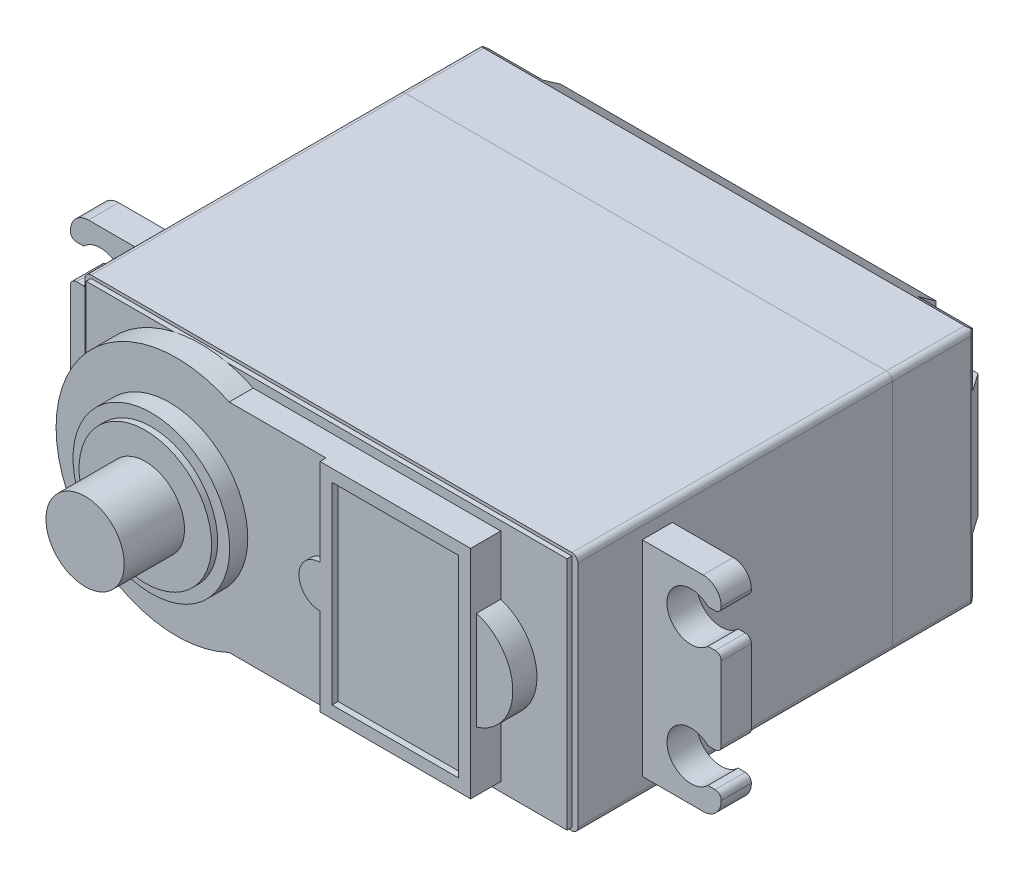
from build123d import *
from OCP.BRepFilletAPI import BRepFilletAPI_MakeChamfer

# Parameters (mm, degrees)
SKETCH1_W            = 40.9
SKETCH1_H            = 20
BOSS_EXTRUDE1_DEPTH  = 19.3
SKETCH2_W            = 40.9
SKETCH2_H            = 20
BOSS_EXTRUDE2_DEPTH  = 6.8
SKETCH3_W            = 40.9
SKETCH3_H            = 20
BOSS_EXTRUDE3_DEPTH  = 8.5
CHAMFER1_SIZE        = 2
CHAMFER1_SIZE2       = 1.400415076
CUT_EXTRUDE1_DEPTH   = 1.5
SKETCH5_W            = 39.9
SKETCH5_H            = 19.5
BOSS_EXTRUDE4_DEPTH  = 0.4
BOSS_EXTRUDE5_DEPTH  = 2
SKETCH7_R            = 6.5
BOSS_EXTRUDE6_DEPTH  = 1.5
SKETCH8_R            = 5.5
BOSS_EXTRUDE7_DEPTH  = 0.5
SKETCH9_R            = 3.25
BOSS_EXTRUDE8_DEPTH  = 5
SKETCH10_W           = 10.5
SKETCH10_H           = 15.998933302
BOSS_EXTRUDE9_DEPTH  = 0.5
FILLET1_R            = 0.5
FILLET2_R            = 0.5
FILLET4_R            = 0.5
BOSS_EXTRUDE10_START = -5.74
BOSS_EXTRUDE10_DEPTH = 2.5


with BuildPart() as part:
    # Sketch1 → Boss-Extrude1 (new body)
    with BuildSketch(Plane.XY):
        Rectangle(SKETCH1_W, SKETCH1_H)
    extrude(amount=BOSS_EXTRUDE1_DEPTH)

    # Fillet1
    fillet1_edges = [part.edges().sort_by_distance(p)[0] for p in [
        (20.45, -10, 9.65),
        (-20.45, -10, 9.65),
        (-20.45, 10, 9.65),
        (20.45, 10, 9.65),
    ]]
    fillet(fillet1_edges, radius=FILLET1_R)



with BuildPart() as body_2:
    # Sketch2 → Boss-Extrude2 (new body)
    with BuildSketch(Plane.XY.offset(19.3)):
        Rectangle(SKETCH2_W, SKETCH2_H)
    extrude(amount=BOSS_EXTRUDE2_DEPTH)

    # Sketch5 → Boss-Extrude4 (add)
    with BuildSketch(Plane.XY.offset(26.1)):
        Rectangle(SKETCH5_W, SKETCH5_H)
    extrude(amount=BOSS_EXTRUDE4_DEPTH)

    # Sketch6 → Boss-Extrude5 (add)
    with BuildSketch(Plane.XY.offset(26.5)):
        with BuildLine():
            Line((-6.09, 8.999466651), (14.45, 8.999466651))
            Line((14.45, 8.999466651), (14.45, 4.095176826))
            ThreePointArc((14.45, 4.095176826), (17.45, 0), (14.45, -4.095176826))
            Line((14.45, -4.095176826), (14.45, -8.999466651))
            Line((14.45, -8.999466651), (-6.09, -8.999466651))
            ThreePointArc((-6.09, -8.999466651), (-20.45, 0), (-6.09, 8.999466651))
        make_face()
    extrude(amount=BOSS_EXTRUDE5_DEPTH)

    # Sketch7 → Boss-Extrude6 (add)
    with BuildSketch(Plane.XY.offset(28.5)):
        with Locations((-11.043616273, 0)):
            Circle(SKETCH7_R)
    extrude(amount=BOSS_EXTRUDE6_DEPTH)

    # Sketch8 → Boss-Extrude7 (add)
    with BuildSketch(Plane.XY.offset(30)):
        with Locations((-11.043616273, 0)):
            Circle(SKETCH8_R)
    extrude(amount=BOSS_EXTRUDE7_DEPTH)

    # Sketch9 → Boss-Extrude8 (add)
    with BuildSketch(Plane.XY.offset(30.5)):
        with Locations((-11.043616273, 0)):
            Circle(SKETCH9_R)
    extrude(amount=BOSS_EXTRUDE8_DEPTH)

    # Sketch10 → Boss-Extrude9 (add)
    with BuildSketch(Plane.XY.offset(28.5)):
        with BuildLine():
            Line((1.95, 8.999466651), (14.45, 8.999466651))
            Line((14.45, 8.999466651), (14.45, -8.999466651))
            Line((14.45, -8.999466651), (1.95, -8.999466651))
            Line((1.95, -8.999466651), (1.95, -1.75))
            ThreePointArc((1.95, -1.75), (0.2, 0), (1.95, 1.75))
            Line((1.95, 1.75), (1.95, 8.999466651))
        make_face()
        with Locations((8.2, 0)):
            Rectangle(SKETCH10_W, SKETCH10_H, mode=Mode.SUBTRACT)
    extrude(amount=BOSS_EXTRUDE9_DEPTH)

    # Fillet2
    fillet2_edges = [body_2.edges().sort_by_distance(p)[0] for p in [
        (-20.45, -10, 22.7),
        (-20.45, 10, 22.7),
        (20.45, 10, 22.7),
        (20.45, -10, 22.7),
    ]]
    fillet(fillet2_edges, radius=FILLET2_R)


with BuildPart() as body_3:
    # Sketch3 → Boss-Extrude3 (new body)
    with BuildSketch(Plane(origin=(0, 0, 0), x_dir=(-1, 0, 0), z_dir=(0, 0, -1))):
        Rectangle(SKETCH3_W, SKETCH3_H)
    extrude(amount=BOSS_EXTRUDE3_DEPTH)

    # Chamfer1: one chamfer whose edges measure the first distance from different faces: ONE call of the kernel's chamfer builder (chamfer() names one face for all edges)
    chamfer1_edges_1 = [body_3.edges().sort_by_distance(p)[0] for p in [
        (0, -10, -8.5),
    ]]
    chamfer1_side_1 = [body_3.faces().sort_by_distance(p)[0] for p in [
        (0, -10, -4.25),
    ]]
    chamfer1_edges_2 = [body_3.edges().sort_by_distance(p)[0] for p in [
        (-20.45, 0, -8.5),
    ]]
    chamfer1_side_2 = [body_3.faces().sort_by_distance(p)[0] for p in [
        (-20.45, 0, -4.25),
    ]]
    chamfer1_edges_3 = [body_3.edges().sort_by_distance(p)[0] for p in [
        (0, 10, -8.5),
    ]]
    chamfer1_side_3 = [body_3.faces().sort_by_distance(p)[0] for p in [
        (0, 10, -4.25),
    ]]
    chamfer1_edges_4 = [body_3.edges().sort_by_distance(p)[0] for p in [
        (20.45, 0, -8.5),
    ]]
    chamfer1_side_4 = [body_3.faces().sort_by_distance(p)[0] for p in [
        (20.45, 0, -4.25),
    ]]
    chamfer1 = BRepFilletAPI_MakeChamfer(body_3.part.solid().wrapped)
    for e in chamfer1_edges_1:
        chamfer1.Add(CHAMFER1_SIZE, CHAMFER1_SIZE2, e.wrapped, chamfer1_side_1[0].wrapped)  # the first distance lies on this face
    for e in chamfer1_edges_2:
        chamfer1.Add(CHAMFER1_SIZE, CHAMFER1_SIZE2, e.wrapped, chamfer1_side_2[0].wrapped)  # the first distance lies on this face
    for e in chamfer1_edges_3:
        chamfer1.Add(CHAMFER1_SIZE, CHAMFER1_SIZE2, e.wrapped, chamfer1_side_3[0].wrapped)  # the first distance lies on this face
    for e in chamfer1_edges_4:
        chamfer1.Add(CHAMFER1_SIZE, CHAMFER1_SIZE2, e.wrapped, chamfer1_side_4[0].wrapped)  # the first distance lies on this face
    add(Compound.cast(chamfer1.Shape()), mode=Mode.REPLACE)

    # Sketch4 → Cut-Extrude1 (cut)
    with BuildSketch(Plane(origin=(0, 0, -8.5), x_dir=(-1, 0, 0), z_dir=(0, 0, -1))):
        with BuildLine():
            Line((-20.45, 10), (-15.57, 10))
            Line((-15.57, 10), (-15.57, 7.12))
            ThreePointArc((-15.57, 7.12), (-16.155786438, 5.705786438), (-17.57, 5.12))
            Line((-17.57, 5.12), (-20.45, 5.12))
            Line((-20.45, 5.12), (-20.45, 10))
        make_face()
        with BuildLine():
            Line((20.45, 5.12), (17.57, 5.12))
            ThreePointArc((17.57, 5.12), (16.155786438, 5.705786438), (15.57, 7.12))
            Line((15.57, 7.12), (15.57, 10))
            Line((15.57, 10), (20.45, 10))
            Line((20.45, 10), (20.45, 5.12))
        make_face()
        with BuildLine():
            Line((15.57, -10), (15.57, -7.12))
            ThreePointArc((15.57, -7.12), (16.155786438, -5.705786438), (17.57, -5.12))
            Line((17.57, -5.12), (20.45, -5.12))
            Line((20.45, -5.12), (20.45, -10))
            Line((20.45, -10), (15.57, -10))
        make_face()
        with BuildLine():
            Line((-15.57, -10), (-15.57, -7.12))
            ThreePointArc((-15.57, -7.12), (-16.155786438, -5.705786438), (-17.57, -5.12))
            Line((-17.57, -5.12), (-20.45, -5.12))
            Line((-20.45, -5.12), (-20.45, -10))
            Line((-20.45, -10), (-15.57, -10))
        make_face()
    extrude(amount=-CUT_EXTRUDE1_DEPTH, mode=Mode.SUBTRACT)

    # Fillet4
    fillet4_edges = [body_3.edges().sort_by_distance(p)[0] for p in [
        (-20.45, 10, -3.25),
        (-20.45, -10, -3.25),
        (20.45, -10, -3.25),
        (20.45, 10, -3.25),
    ]]
    fillet(fillet4_edges, radius=FILLET4_R)


with BuildPart() as part_1:
    add(part.part)

    add(body_2.part)  # Boss-Extrude10 merges body 2
    # Sketch11 → Boss-Extrude10 (add)
    with BuildSketch(Plane.XY.offset(26.5).offset(BOSS_EXTRUDE10_START)):
        with BuildLine():
            Line((20.45, 8.5), (25.5, 8.5))
            ThreePointArc((25.5, 8.5), (26.560660172, 8.060660172), (27, 7))
            Line((27, 7), (27, 6.928285686))
            ThreePointArc((27, 6.928285686), (26.853553391, 6.574732295), (26.5, 6.428285686))
            Line((26.5, 6.428285686), (25.9, 6.428285686))
            ThreePointArc((25.9, 6.428285686), (22.5, 5), (25.9, 3.571714314))
            Line((25.9, 3.571714314), (26.5, 3.571714314))
            ThreePointArc((26.5, 3.571714314), (26.853553391, 3.425267705), (27, 3.071714314))
            Line((27, 3.071714314), (27, -3.071714314))
            ThreePointArc((27, -3.071714314), (26.853553391, -3.425267705), (26.5, -3.571714314))
            Line((26.5, -3.571714314), (25.9, -3.571714314))
            ThreePointArc((25.9, -3.571714314), (22.5, -5), (25.9, -6.428285686))
            Line((25.9, -6.428285686), (26.5, -6.428285686))
            ThreePointArc((26.5, -6.428285686), (26.853553391, -6.574732295), (27, -6.928285686))
            Line((27, -6.928285686), (27, -7))
            ThreePointArc((27, -7), (26.560660172, -8.060660172), (25.5, -8.5))
            Line((25.5, -8.5), (20.45, -8.5))
            Line((20.45, -8.5), (20.45, 8.5))
        make_face()
    boss_extrude10 = extrude(amount=-BOSS_EXTRUDE10_DEPTH)

    # Mirror1: Boss-Extrude10 across plane
    add(boss_extrude10.mirror(Plane(origin=(0, 0, 0), x_dir=(0, 0, 1), z_dir=(1, 0, 0))))


solid = Compound([body_3.part, part_1.part])
